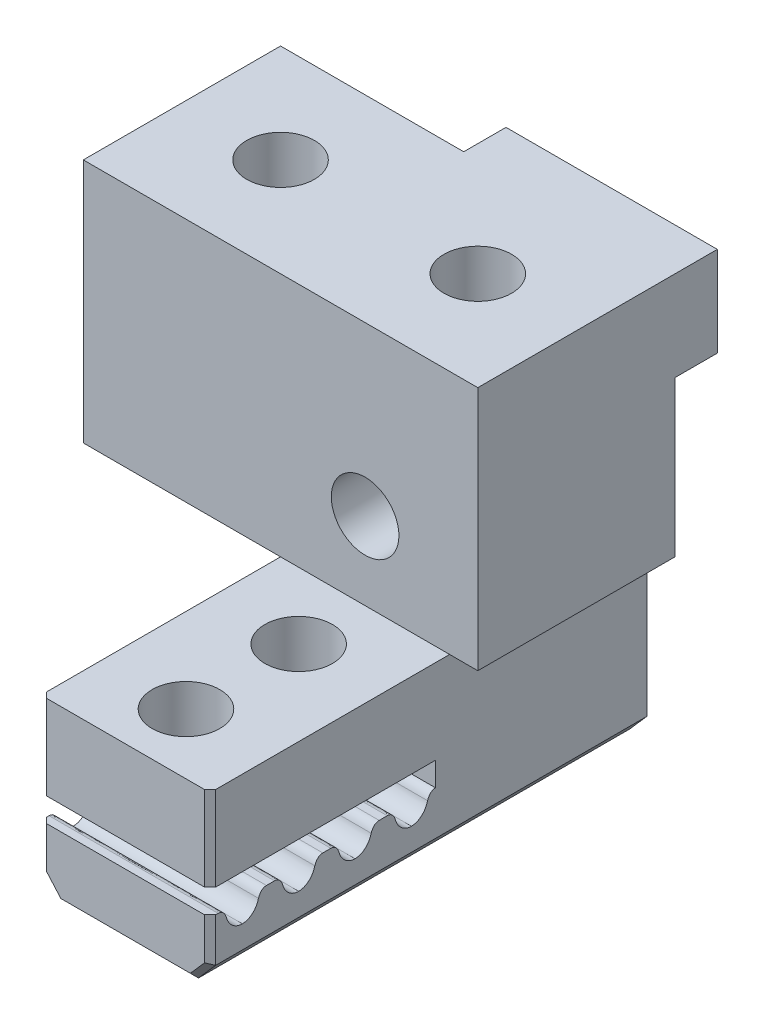
from build123d import *

# Parameters (mm, degrees)
BOSS_EXTRUDE1_DEPTH     = 13
SKETCH6_W               = 6
SKETCH6_H               = 5
BOSS_EXTRUDE4_DEPTH     = 5.6
SKETCH16_W              = 6
SKETCH16_H              = 8
BOSS_EXTRUDE5_DEPTH     = 0.1
CUT_EXTRUDE6_DEPTH      = 4
CUT_EXTRUDE6_DEPTH_BACK = 3.6
SKETCH15_R              = 1.2
CUT_EXTRUDE7_DEPTH      = 8.7202
CUT_EXTRUDE8_START      = -0.2202
SKETCH19_W              = 6
SKETCH19_H              = 8
SKETCH19_R              = 1.2
CUT_EXTRUDE8_DEPTH      = 0.2202
SKETCH12_R              = 1.2
CUT_EXTRUDE5_DEPTH      = 6
CHAMFER1_SIZE           = 0.2
SKETCH21_R              = 1.2
BOSS_EXTRUDE6_DEPTH     = 2.5
SKETCH24_W              = 6
SKETCH24_H              = 5.5
CUT_EXTRUDE10_DEPTH     = 8.5
SKETCH25_W              = 6
SKETCH25_H              = 7
BOSS_EXTRUDE8_DEPTH     = 12.9
SKETCH26_W              = 6
SKETCH26_H              = 7.39
BOSS_EXTRUDE9_DEPTH     = 3
SKETCH30_R              = 1.2
CUT_EXTRUDE13_DEPTH     = 8
SKETCH31_W              = 7
SKETCH31_H              = 9
BOSS_EXTRUDE11_DEPTH    = 1
SKETCH32_W              = 7
SKETCH32_H              = 9
BOSS_EXTRUDE12_DEPTH    = 1
BOSS_EXTRUDE13_DEPTH    = 1
BOSS_EXTRUDE14_DEPTH    = 1
SKETCH35_W              = 10
SKETCH35_H              = 4.2
CUT_EXTRUDE14_DEPTH     = 10
BOSS_EXTRUDE15_DEPTH    = 6
SKETCH38_R              = 1.2
CUT_EXTRUDE15_DEPTH     = 4
SKETCH39_R              = 1.2
CUT_EXTRUDE16_DEPTH     = 10
SKETCH40_W              = 14
SKETCH40_H              = 1.5
CUT_EXTRUDE17_DEPTH     = 10
SKETCH41_W              = 6.5
SKETCH41_H              = 3.19
CUT_EXTRUDE18_DEPTH     = 1.5


with BuildPart() as part:
    # Sketch1 → Boss-Extrude1 (new body)
    with BuildSketch(Plane.XY):
        Polygon((3, 3.05), (3, -2.253801214), (2.388188946, -2.95), (-2.388188946, -2.95), (-3, -2.253801214), (-3, 3.05), align=None)
    extrude(amount=BOSS_EXTRUDE1_DEPTH)

    # Sketch6 → Boss-Extrude4 (add)
    with BuildSketch(Plane(origin=(0, 3.05, 0), x_dir=(1, 0, 0), z_dir=(0, 1, 0))):
        with Locations((0, -2.5)):
            Rectangle(SKETCH6_W, SKETCH6_H)
    extrude(amount=BOSS_EXTRUDE4_DEPTH)

    # Sketch16 → Boss-Extrude5 (add)
    with BuildSketch(Plane(origin=(0, 3.05, 0), x_dir=(1, 0, 0), z_dir=(0, 1, 0))):
        with Locations((0, -9)):
            Rectangle(SKETCH16_W, SKETCH16_H)
    extrude(amount=BOSS_EXTRUDE5_DEPTH)

    # Sketch18 → Cut-Extrude6 (cut, two sides: drawn at the far end of the back side and taken through both)
    with BuildSketch(Plane(origin=(0, 0, 0), x_dir=(0, 0, -1), z_dir=(1, 0, 0)).offset(-CUT_EXTRUDE6_DEPTH_BACK)):
        with BuildLine():
            Line((-8.8572, -0.0702), (-12.8572, -0.0702))
            Line((-12.8572, -0.0702), (-13, -0.0702))
            Line((-13, -0.0702), (-13, -0.7))
            Line((-13, -0.7), (-12.8572, -0.7))
            Line((-12.8572, -0.7), (-12.7144, -0.7))
            add(Edge.make_bspline(
                [(-12.7144, -0.7), (-12.5198, -0.7), (-12.43, -0.9509)],
                knots=[0.103448276, 0.103448276, 0.103448276, 0.137931034, 0.137931034, 0.137931034], degree=2))
            add(Edge.make_bspline(
                [(-12.43, -0.9509), (-12.3594, -1.2388), (-12.13, -1.45), (-11.8572, -1.45)],
                knots=[0.137931034, 0.137931034, 0.137931034, 0.137931034, 0.172413793, 0.172413793, 0.172413793, 0.172413793], degree=3))
            add(Edge.make_bspline(
                [(-11.8572, -1.45), (-11.5844, -1.45), (-11.355, -1.2388), (-11.2844, -0.9509)],
                knots=[0.172413793, 0.172413793, 0.172413793, 0.172413793, 0.206896552, 0.206896552, 0.206896552, 0.206896552], degree=3))
            add(Edge.make_bspline(
                [(-11.2844, -0.9509), (-11.1946, -0.7), (-11, -0.7)],
                knots=[0.206896552, 0.206896552, 0.206896552, 0.24137931, 0.24137931, 0.24137931], degree=2))
            Line((-11, -0.7), (-10.8572, -0.7))
            Line((-10.8572, -0.7), (-10.7144, -0.7))
            add(Edge.make_bspline(
                [(-10.7144, -0.7), (-10.5198, -0.7), (-10.43, -0.9509)],
                knots=[0.310344828, 0.310344828, 0.310344828, 0.344827586, 0.344827586, 0.344827586], degree=2))
            add(Edge.make_bspline(
                [(-10.43, -0.9509), (-10.3594, -1.2388), (-10.13, -1.45), (-9.8572, -1.45)],
                knots=[0.344827586, 0.344827586, 0.344827586, 0.344827586, 0.379310345, 0.379310345, 0.379310345, 0.379310345], degree=3))
            add(Edge.make_bspline(
                [(-9.8572, -1.45), (-9.5844, -1.45), (-9.355, -1.2388), (-9.2844, -0.9509)],
                knots=[0.379310345, 0.379310345, 0.379310345, 0.379310345, 0.413793103, 0.413793103, 0.413793103, 0.413793103], degree=3))
            add(Edge.make_bspline(
                [(-9.2844, -0.9509), (-9.1946, -0.7), (-9, -0.7)],
                knots=[0.413793103, 0.413793103, 0.413793103, 0.448275862, 0.448275862, 0.448275862], degree=2))
            Line((-9, -0.7), (-8.8572, -0.7))
            Line((-8.8572, -0.7), (-8.7144, -0.7))
            add(Edge.make_bspline(
                [(-8.7144, -0.7), (-8.5198, -0.7), (-8.43, -0.9509)],
                knots=[0.517241379, 0.517241379, 0.517241379, 0.551724138, 0.551724138, 0.551724138], degree=2))
            add(Edge.make_bspline(
                [(-8.43, -0.9509), (-8.3594, -1.2388), (-8.13, -1.45), (-7.8572, -1.45)],
                knots=[0.551724138, 0.551724138, 0.551724138, 0.551724138, 0.586206897, 0.586206897, 0.586206897, 0.586206897], degree=3))
            add(Edge.make_bspline(
                [(-7.8572, -1.45), (-7.5844, -1.45), (-7.355, -1.2388), (-7.2844, -0.9509)],
                knots=[0.586206897, 0.586206897, 0.586206897, 0.586206897, 0.620689655, 0.620689655, 0.620689655, 0.620689655], degree=3))
            add(Edge.make_bspline(
                [(-7.2844, -0.9509), (-7.1946, -0.7), (-7, -0.7)],
                knots=[0.620689655, 0.620689655, 0.620689655, 0.655172414, 0.655172414, 0.655172414], degree=2))
            Line((-7, -0.7), (-6.8572, -0.7))
            Line((-6.8572, -0.7), (-6.7144, -0.7))
            add(Edge.make_bspline(
                [(-6.7144, -0.7), (-6.5198, -0.7), (-6.43, -0.9509)],
                knots=[0.724137931, 0.724137931, 0.724137931, 0.75862069, 0.75862069, 0.75862069], degree=2))
            add(Edge.make_bspline(
                [(-6.43, -0.9509), (-6.3594, -1.2388), (-6.13, -1.45), (-5.8572, -1.45)],
                knots=[0.75862069, 0.75862069, 0.75862069, 0.75862069, 0.793103448, 0.793103448, 0.793103448, 0.793103448], degree=3))
            add(Edge.make_bspline(
                [(-5.8572, -1.45), (-5.5844, -1.45), (-5.355, -1.2388), (-5.2844, -0.9509)],
                knots=[0.793103448, 0.793103448, 0.793103448, 0.793103448, 0.827586207, 0.827586207, 0.827586207, 0.827586207], degree=3))
            add(Edge.make_bspline(
                [(-5.2844, -0.9509), (-5.1946, -0.7), (-5, -0.7)],
                knots=[0.827586207, 0.827586207, 0.827586207, 0.862068966, 0.862068966, 0.862068966], degree=2))
            Line((-5, -0.7), (-5, -0.0702))
            Line((-5, -0.0702), (-8.8572, -0.0702))
        make_face()
    extrude(amount=CUT_EXTRUDE6_DEPTH + CUT_EXTRUDE6_DEPTH_BACK, mode=Mode.SUBTRACT)

    # Sketch15 → Cut-Extrude7 (cut)
    with BuildSketch(Plane(origin=(0, 8.65, 0), x_dir=(1, 0, 0), z_dir=(0, 1, 0))):
        with Locations(Location((0, -10.8572, 0), (0, 0, 180))):
            Circle(SKETCH15_R)
        with Locations(Location((0, -6.8572, 0), (0, 0, 180))):
            Circle(SKETCH15_R)
    extrude(amount=-CUT_EXTRUDE7_DEPTH, mode=Mode.SUBTRACT)

    # Sketch19 → Cut-Extrude8 (cut)
    with BuildSketch(Plane.XZ.offset(0.0702).offset(CUT_EXTRUDE8_START)):
        with Locations((0, 9)):
            Rectangle(SKETCH19_W, SKETCH19_H)
        with Locations(Location((0, 10.8572, 0), (0, 0, 180))):
            Circle(SKETCH19_R, mode=Mode.SUBTRACT)
        with Locations(Location((0, 6.8572, 0), (0, 0, 180))):
            Circle(SKETCH19_R, mode=Mode.SUBTRACT)
    extrude(amount=CUT_EXTRUDE8_DEPTH, mode=Mode.SUBTRACT)

    # Sketch12 → Cut-Extrude5 (cut)
    with BuildSketch(Plane.XY.offset(5)):
        with Locations((0, 5.85)):
            Circle(SKETCH12_R)
    extrude(amount=-CUT_EXTRUDE5_DEPTH, mode=Mode.SUBTRACT)

    # Chamfer1
    chamfer1_edges = [part.edges().sort_by_distance(p)[0] for p in [
        (-2.694094473, -2.601900607, 13),
        (0, -2.95, 13),
        (2.694094473, -2.601900607, 13),
        (3, 1.65, 13),
        (3, -1.476900607, 13),
        (-3, -1.476900607, 13),
        (-3, 1.65, 13),
    ]]
    chamfer(chamfer1_edges, length=CHAMFER1_SIZE)

    # Sketch21 → Boss-Extrude6 (add)
    with BuildSketch(Plane(origin=(0, 0, 0), x_dir=(-1, 0, 0), z_dir=(0, 0, -1))):
        Polygon((-2.388188946, -2.95), (2.388188946, -2.95), (3, -2.253801214), (3, 8.65), (-3, 8.65), (-3, -2.253801214), align=None)
        with Locations(Location((0, 5.85, 0), (0, 0, 180))):
            Circle(SKETCH21_R, mode=Mode.SUBTRACT)
    extrude(amount=BOSS_EXTRUDE6_DEPTH)

    # Sketch24 → Cut-Extrude10 (cut)
    with BuildSketch(Plane.XY.offset(5)):
        with Locations((0, 5.9)):
            Rectangle(SKETCH24_W, SKETCH24_H)
    extrude(amount=-CUT_EXTRUDE10_DEPTH, mode=Mode.SUBTRACT)

    # Sketch25 → Boss-Extrude8 (add)
    with BuildSketch(Plane(origin=(0, 3.15, 0), x_dir=(1, 0, 0), z_dir=(0, 1, 0))):
        with Locations((0, -1)):
            Rectangle(SKETCH25_W, SKETCH25_H)
    extrude(amount=BOSS_EXTRUDE8_DEPTH)

    # Sketch26 → Boss-Extrude9 (add)
    with BuildSketch(Plane(origin=(0, 0, -2.5), x_dir=(-1, 0, 0), z_dir=(0, 0, -1))):
        with Locations((0, 12.355)):
            Rectangle(SKETCH26_W, SKETCH26_H)
    extrude(amount=BOSS_EXTRUDE9_DEPTH)

    # Sketch30 → Cut-Extrude13 (cut)
    with BuildSketch(Plane(origin=(0, 0, -2.5), x_dir=(-1, 0, 0), z_dir=(0, 0, -1))):
        with Locations((0, 5.9)):
            Circle(SKETCH30_R)
    extrude(amount=-CUT_EXTRUDE13_DEPTH, mode=Mode.SUBTRACT)

    # Sketch31 → Boss-Extrude11 (add)
    with BuildSketch(Plane(origin=(3, 0, 0), x_dir=(0, 0, -1), z_dir=(1, 0, 0))):
        with Locations((-1, 7.65)):
            Rectangle(SKETCH31_W, SKETCH31_H)
    extrude(amount=BOSS_EXTRUDE11_DEPTH)

    # Sketch32 → Boss-Extrude12 (add)
    with BuildSketch(Plane.ZY.offset(3)):
        with Locations((1, 7.65)):
            Rectangle(SKETCH32_W, SKETCH32_H)
    extrude(amount=BOSS_EXTRUDE12_DEPTH)

    # Sketch33 → Boss-Extrude13 (add)
    with BuildSketch(Plane(origin=(3, 0, 0), x_dir=(0, 0, -1), z_dir=(1, 0, 0))):
        Polygon((2.5, 12.15), (2.5, 8.66), (5.5, 8.66), (5.5, 16.05), (-4.5, 16.05), (-4.5, 12.15), align=None)
    extrude(amount=BOSS_EXTRUDE13_DEPTH)

    # Sketch34 → Boss-Extrude14 (add)
    with BuildSketch(Plane.ZY.offset(3)):
        Polygon((-2.5, 12.15), (4.5, 12.15), (4.5, 16.05), (-5.5, 16.05), (-5.5, 8.66), (-2.5, 8.66), align=None)
    extrude(amount=BOSS_EXTRUDE14_DEPTH)

    # Sketch35 → Cut-Extrude14 (cut)
    with BuildSketch(Plane.ZY.offset(4)):
        with Locations((-0.5, 13.95)):
            Rectangle(SKETCH35_W, SKETCH35_H)
    extrude(amount=-CUT_EXTRUDE14_DEPTH, mode=Mode.SUBTRACT)

    # Sketch36 → Boss-Extrude15 (add)
    with BuildSketch(Plane.ZY.offset(4)):
        Polygon((4.5, 3.15), (4.5, 11.85), (-5.5, 11.85), (-5.5, 8.66), (-2.5, 8.66), (-2.5, 3.15), align=None)
    extrude(amount=BOSS_EXTRUDE15_DEPTH)

    # Sketch38 → Cut-Extrude15 (cut)
    with BuildSketch(Plane(origin=(0, 11.85, 0), x_dir=(1, 0, 0), z_dir=(0, 1, 0))):
        with Locations(Location((0.5, -1, 0), (0, 0, 270))):
            Circle(SKETCH38_R)
    extrude(amount=-CUT_EXTRUDE15_DEPTH, mode=Mode.SUBTRACT)

    # Sketch39 → Cut-Extrude16 (cut)
    with BuildSketch(Plane(origin=(0, 11.85, 0), x_dir=(1, 0, 0), z_dir=(0, 1, 0))):
        with Locations(Location((-6.5, -1, 0), (0, 0, 270))):
            Circle(SKETCH39_R)
    extrude(amount=-CUT_EXTRUDE16_DEPTH, mode=Mode.SUBTRACT)

    # Sketch40 → Cut-Extrude17 (cut)
    with BuildSketch(Plane(origin=(0, 11.85, 0), x_dir=(1, 0, 0), z_dir=(0, 1, 0))):
        with Locations((-3, 4.75)):
            Rectangle(SKETCH40_W, SKETCH40_H)
    extrude(amount=-CUT_EXTRUDE17_DEPTH, mode=Mode.SUBTRACT)

    # Sketch41 → Cut-Extrude18 (cut)
    with BuildSketch(Plane(origin=(0, 0, -4), x_dir=(-1, 0, 0), z_dir=(0, 0, -1))):
        with Locations((6.75, 10.255)):
            Rectangle(SKETCH41_W, SKETCH41_H)
    extrude(amount=-CUT_EXTRUDE18_DEPTH, mode=Mode.SUBTRACT)


solid = part.part
